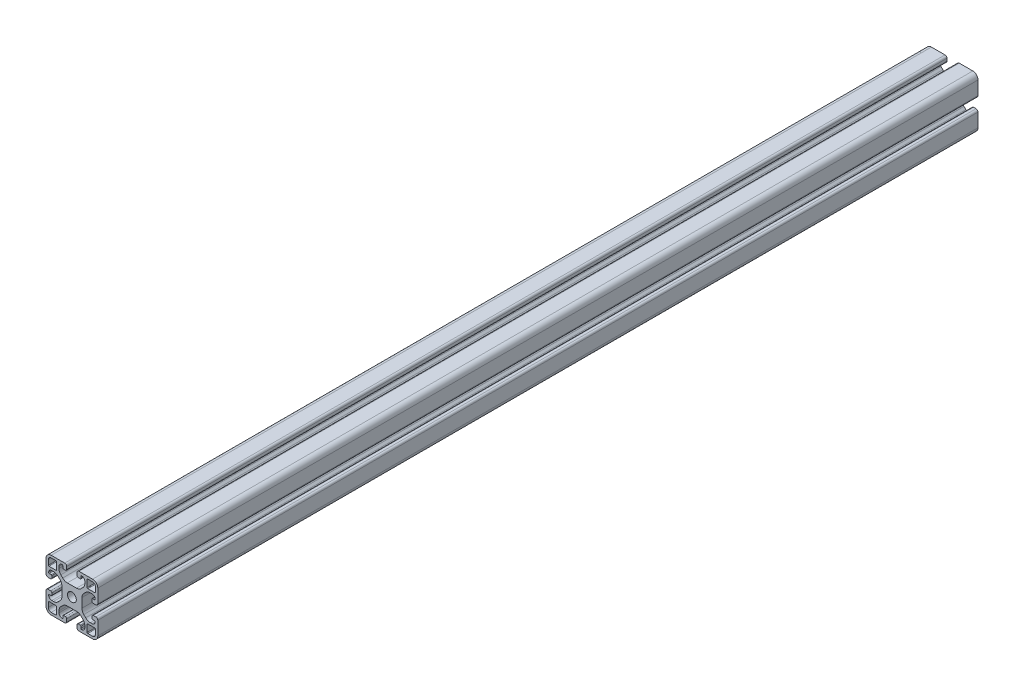
from build123d import *

# Parameters (mm, degrees)
ESQUISSE1_R        = 3.4
BOSS_EXTRU_1_DEPTH = 680


with BuildPart() as part:
    # Esquisse1 → Boss.-Extru.1 (new body)
    with BuildSketch(Plane(origin=(0, 0, -30), x_dir=(-1, 0, 0), z_dir=(0, 0, -1))):
        with BuildLine():
            Line((-4.5, 15), (-4.5, 13.5))
            ThreePointArc((-4.5, 13.5), (-4.353553391, 13.146446609), (-4, 13))
            Line((-4, 13), (-2.5, 13))
            ThreePointArc((-2.5, 13), (-2.146446609, 12.853553391), (-2, 12.5))
            ThreePointArc((-2, 12.5), (-2.732233047, 10.732233047), (-4.5, 10))
            Line((-4.5, 10), (-5.807611845, 10))
            ThreePointArc((-5.807611845, 10), (-7.721029006, 10.380602337), (-9.343145751, 11.464466094))
            Line((-9.343145751, 11.464466094), (-10.785533906, 12.906854249))
            ThreePointArc((-10.785533906, 12.906854249), (-11.869397663, 14.528970994), (-12.25, 16.442388155))
            Line((-12.25, 16.442388155), (-12.25, 23.557611845))
            ThreePointArc((-12.25, 23.557611845), (-11.869397663, 25.471029006), (-10.785533906, 27.093145751))
            Line((-10.785533906, 27.093145751), (-9.343145751, 28.535533906))
            ThreePointArc((-9.343145751, 28.535533906), (-7.721029006, 29.619397663), (-5.807611845, 30))
            Line((-5.807611845, 30), (-4.5, 30))
            ThreePointArc((-4.5, 30), (-2.732233047, 29.267766953), (-2, 27.5))
            ThreePointArc((-2, 27.5), (-2.146446609, 27.146446609), (-2.5, 27))
            Line((-2.5, 27), (-4, 27))
            ThreePointArc((-4, 27), (-4.353553391, 26.853553391), (-4.5, 26.5))
            Line((-4.5, 26.5), (-4.5, 25))
            ThreePointArc((-4.5, 25), (-4.207106781, 24.292893219), (-3.5, 24))
            Line((-3.5, 24), (-1.5, 24))
            ThreePointArc((-1.5, 24), (-0.439339828, 24.439339828), (0, 25.5))
            Line((0, 25.5), (0, 36))
            ThreePointArc((0, 36), (-1.171572875, 38.828427125), (-4, 40))
            Line((-4, 40), (-14.5, 40))
            ThreePointArc((-14.5, 40), (-15.560660172, 39.560660172), (-16, 38.5))
            Line((-16, 38.5), (-16, 36.5))
            ThreePointArc((-16, 36.5), (-15.707106781, 35.792893219), (-15, 35.5))
            Line((-15, 35.5), (-13.5, 35.5))
            ThreePointArc((-13.5, 35.5), (-13.146446609, 35.646446609), (-13, 36))
            Line((-13, 36), (-13, 37.5))
            ThreePointArc((-13, 37.5), (-12.853553391, 37.853553391), (-12.5, 38))
            ThreePointArc((-12.5, 38), (-10.732233047, 37.267766953), (-10, 35.5))
            Line((-10, 35.5), (-10, 34.192388155))
            ThreePointArc((-10, 34.192388155), (-10.380602337, 32.278970994), (-11.464466094, 30.656854249))
            Line((-11.464466094, 30.656854249), (-12.906854249, 29.214466094))
            ThreePointArc((-12.906854249, 29.214466094), (-14.528970994, 28.130602337), (-16.442388155, 27.75))
            Line((-16.442388155, 27.75), (-23.557611845, 27.75))
            ThreePointArc((-23.557611845, 27.75), (-25.471029006, 28.130602337), (-27.093145751, 29.214466094))
            Line((-27.093145751, 29.214466094), (-28.535533906, 30.656854249))
            ThreePointArc((-28.535533906, 30.656854249), (-29.619397663, 32.278970994), (-30, 34.192388155))
            Line((-30, 34.192388155), (-30, 35.5))
            ThreePointArc((-30, 35.5), (-29.267766953, 37.267766953), (-27.5, 38))
            ThreePointArc((-27.5, 38), (-27.146446609, 37.853553391), (-27, 37.5))
            Line((-27, 37.5), (-27, 36))
            ThreePointArc((-27, 36), (-26.853553391, 35.646446609), (-26.5, 35.5))
            Line((-26.5, 35.5), (-25, 35.5))
            ThreePointArc((-25, 35.5), (-24.292893219, 35.792893219), (-24, 36.5))
            Line((-24, 36.5), (-24, 38.5))
            ThreePointArc((-24, 38.5), (-24.439339828, 39.560660172), (-25.5, 40))
            Line((-25.5, 40), (-36, 40))
            ThreePointArc((-36, 40), (-38.828427125, 38.828427125), (-40, 36))
            Line((-40, 36), (-40, 25.5))
            ThreePointArc((-40, 25.5), (-39.560660172, 24.439339828), (-38.5, 24))
            Line((-38.5, 24), (-36.5, 24))
            ThreePointArc((-36.5, 24), (-35.792893219, 24.292893219), (-35.5, 25))
            Line((-35.5, 25), (-35.5, 26.5))
            ThreePointArc((-35.5, 26.5), (-35.646446609, 26.853553391), (-36, 27))
            Line((-36, 27), (-37.5, 27))
            ThreePointArc((-37.5, 27), (-37.853553391, 27.146446609), (-38, 27.5))
            ThreePointArc((-38, 27.5), (-37.267766953, 29.267766953), (-35.5, 30))
            Line((-35.5, 30), (-34.192388155, 30))
            ThreePointArc((-34.192388155, 30), (-32.278970994, 29.619397663), (-30.656854249, 28.535533906))
            Line((-30.656854249, 28.535533906), (-29.214466094, 27.093145751))
            ThreePointArc((-29.214466094, 27.093145751), (-28.130602337, 25.471029006), (-27.75, 23.557611845))
            Line((-27.75, 23.557611845), (-27.75, 16.442388155))
            ThreePointArc((-27.75, 16.442388155), (-28.130602337, 14.528970994), (-29.214466094, 12.906854249))
            Line((-29.214466094, 12.906854249), (-30.656854249, 11.464466094))
            ThreePointArc((-30.656854249, 11.464466094), (-32.278970994, 10.380602337), (-34.192388155, 10))
            Line((-34.192388155, 10), (-35.5, 10))
            ThreePointArc((-35.5, 10), (-37.267766953, 10.732233047), (-38, 12.5))
            ThreePointArc((-38, 12.5), (-37.853553391, 12.853553391), (-37.5, 13))
            Line((-37.5, 13), (-36, 13))
            ThreePointArc((-36, 13), (-35.646446609, 13.146446609), (-35.5, 13.5))
            Line((-35.5, 13.5), (-35.5, 15))
            ThreePointArc((-35.5, 15), (-35.792893219, 15.707106781), (-36.5, 16))
            Line((-36.5, 16), (-38.5, 16))
            ThreePointArc((-38.5, 16), (-39.560660172, 15.560660172), (-40, 14.5))
            Line((-40, 14.5), (-40, 4))
            ThreePointArc((-40, 4), (-38.828427125, 1.171572875), (-36, 0))
            Line((-36, 0), (-25.5, 0))
            ThreePointArc((-25.5, 0), (-24.439339828, 0.439339828), (-24, 1.5))
            Line((-24, 1.5), (-24, 3.5))
            ThreePointArc((-24, 3.5), (-24.292893219, 4.207106781), (-25, 4.5))
            Line((-25, 4.5), (-26.5, 4.5))
            ThreePointArc((-26.5, 4.5), (-26.853553391, 4.353553391), (-27, 4))
            Line((-27, 4), (-27, 2.5))
            ThreePointArc((-27, 2.5), (-27.146446609, 2.146446609), (-27.5, 2))
            ThreePointArc((-27.5, 2), (-29.267766953, 2.732233047), (-30, 4.5))
            Line((-30, 4.5), (-30, 5.807611845))
            ThreePointArc((-30, 5.807611845), (-29.619397663, 7.721029006), (-28.535533906, 9.343145751))
            Line((-28.535533906, 9.343145751), (-27.093145751, 10.785533906))
            ThreePointArc((-27.093145751, 10.785533906), (-25.471029006, 11.869397663), (-23.557611845, 12.25))
            Line((-23.557611845, 12.25), (-16.442388155, 12.25))
            ThreePointArc((-16.442388155, 12.25), (-14.528970994, 11.869397663), (-12.906854249, 10.785533906))
            Line((-12.906854249, 10.785533906), (-11.464466094, 9.343145751))
            ThreePointArc((-11.464466094, 9.343145751), (-10.380602337, 7.721029006), (-10, 5.807611845))
            Line((-10, 5.807611845), (-10, 4.5))
            ThreePointArc((-10, 4.5), (-10.732233047, 2.732233047), (-12.5, 2))
            ThreePointArc((-12.5, 2), (-12.853553391, 2.146446609), (-13, 2.5))
            Line((-13, 2.5), (-13, 4))
            ThreePointArc((-13, 4), (-13.146446609, 4.353553391), (-13.5, 4.5))
            Line((-13.5, 4.5), (-15, 4.5))
            ThreePointArc((-15, 4.5), (-15.707106781, 4.207106781), (-16, 3.5))
            Line((-16, 3.5), (-16, 1.5))
            ThreePointArc((-16, 1.5), (-15.560660172, 0.439339828), (-14.5, 0))
            Line((-14.5, 0), (-4, 0))
            ThreePointArc((-4, 0), (-1.171572875, 1.171572875), (0, 4))
            Line((0, 4), (0, 14.5))
            ThreePointArc((0, 14.5), (-0.439339828, 15.560660172), (-1.5, 16))
            Line((-1.5, 16), (-3.5, 16))
            ThreePointArc((-3.5, 16), (-4.207106781, 15.707106781), (-4.5, 15))
        make_face()
        with Locations(Location((-20, 20, 0), (0, 0, 180))):
            Circle(ESQUISSE1_R, mode=Mode.SUBTRACT)
        with BuildLine():
            Line((-4, 1.8), (-7.7, 1.8))
            ThreePointArc((-7.7, 1.8), (-8.053553391, 1.946446609), (-8.2, 2.3))
            Line((-8.2, 2.3), (-8.2, 7.7))
            ThreePointArc((-8.2, 7.7), (-8.053553391, 8.053553391), (-7.7, 8.2))
            Line((-7.7, 8.2), (-2.3, 8.2))
            ThreePointArc((-2.3, 8.2), (-1.946446609, 8.053553391), (-1.8, 7.7))
            Line((-1.8, 7.7), (-1.8, 4))
            ThreePointArc((-1.8, 4), (-2.444365081, 2.444365081), (-4, 1.8))
        make_face(mode=Mode.SUBTRACT)
        with BuildLine():
            Line((-38.2, 4), (-38.2, 7.7))
            ThreePointArc((-38.2, 7.7), (-38.053553391, 8.053553391), (-37.7, 8.2))
            Line((-37.7, 8.2), (-32.3, 8.2))
            ThreePointArc((-32.3, 8.2), (-31.946446609, 8.053553391), (-31.8, 7.7))
            Line((-31.8, 7.7), (-31.8, 2.3))
            ThreePointArc((-31.8, 2.3), (-31.946446609, 1.946446609), (-32.3, 1.8))
            Line((-32.3, 1.8), (-36, 1.8))
            ThreePointArc((-36, 1.8), (-37.555634919, 2.444365081), (-38.2, 4))
        make_face(mode=Mode.SUBTRACT)
        with BuildLine():
            Line((-36, 38.2), (-32.3, 38.2))
            ThreePointArc((-32.3, 38.2), (-31.946446609, 38.053553391), (-31.8, 37.7))
            Line((-31.8, 37.7), (-31.8, 32.3))
            ThreePointArc((-31.8, 32.3), (-31.946446609, 31.946446609), (-32.3, 31.8))
            Line((-32.3, 31.8), (-37.7, 31.8))
            ThreePointArc((-37.7, 31.8), (-38.053553391, 31.946446609), (-38.2, 32.3))
            Line((-38.2, 32.3), (-38.2, 36))
            ThreePointArc((-38.2, 36), (-37.555634919, 37.555634919), (-36, 38.2))
        make_face(mode=Mode.SUBTRACT)
        with BuildLine():
            Line((-1.8, 36), (-1.8, 32.3))
            ThreePointArc((-1.8, 32.3), (-1.946446609, 31.946446609), (-2.3, 31.8))
            Line((-2.3, 31.8), (-7.7, 31.8))
            ThreePointArc((-7.7, 31.8), (-8.053553391, 31.946446609), (-8.2, 32.3))
            Line((-8.2, 32.3), (-8.2, 37.7))
            ThreePointArc((-8.2, 37.7), (-8.053553391, 38.053553391), (-7.7, 38.2))
            Line((-7.7, 38.2), (-4, 38.2))
            ThreePointArc((-4, 38.2), (-2.444365081, 37.555634919), (-1.8, 36))
        make_face(mode=Mode.SUBTRACT)
    extrude(amount=-BOSS_EXTRU_1_DEPTH)


solid = part.part
